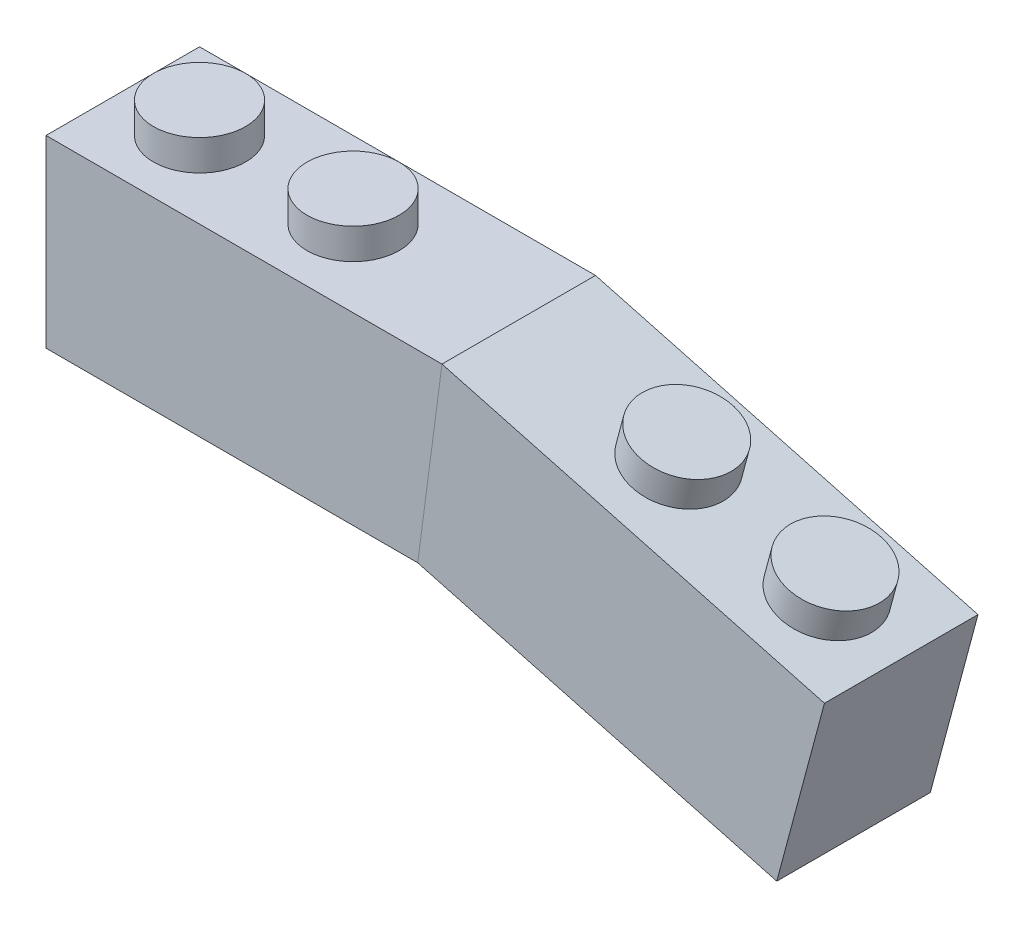
from build123d import *

# Parameters (mm, degrees)
SKETCH2_W           = 8
SKETCH2_H           = 9.6
SKETCH4_R           = 2.4
BOSS_EXTRUDE1_DEPTH = 1.6
LPATTERN1_COUNT     = 2
LPATTERN1_PITCH     = 8
SKETCH5_R           = 2.4
BOSS_EXTRUDE2_DEPTH = 1.6
LPATTERN2_COUNT     = 2
LPATTERN2_PITCH     = 8
SHELL1_T            = -1.6


with BuildPart() as part:
    # Sweep1: sweep along a path in Sketch3
    with BuildLine(Plane.XY) as sweep1_path:
        Line((0, 0), (20, 0))
        Line((20, 0), (39.318516526, -5.176380902))
    # Sketch2 → Sweep1 (sweep)
    with BuildSketch(Plane(origin=(0, 0, 0), x_dir=(0, 0, -1), z_dir=(1, 0, 0))):
        Rectangle(SKETCH2_W, SKETCH2_H)
    sweep(path=sweep1_path.line, transition=Transition.RIGHT)

    # Sketch4 → Boss-Extrude1 (add)
    with BuildSketch(Plane(origin=(0, 4.8, 0), x_dir=(1, 0, 0), z_dir=(0, 1, 0))):
        with Locations(Location((4, 0, 0), (0, 0, 270))):
            Circle(SKETCH4_R)
    boss_extrude1 = extrude(amount=BOSS_EXTRUDE1_DEPTH)

    # LPattern1: Boss-Extrude1 ×2
    with Locations(*[(i * LPATTERN1_PITCH, 0, 0) for i in range(1, LPATTERN1_COUNT)]):
        add(boss_extrude1)

    # Sketch5 → Boss-Extrude2 (add)
    with BuildSketch(Plane(origin=(2.582077379, 9.636443966, 0), x_dir=(0.9659258262890681, -0.25881904510252135, 0), z_dir=(0.25881904510252135, 0.9659258262890681, 0))):
        with Locations(Location((35.318516526, 0, 0), (0, 0, 180))):
            Circle(SKETCH5_R)
    boss_extrude2 = extrude(amount=BOSS_EXTRUDE2_DEPTH)

    # LPattern2: Boss-Extrude2 ×2
    with Locations(*[Vector(-0.9659258262890681, 0.2588190451025216, 0) * (i * LPATTERN2_PITCH) for i in range(1, LPATTERN2_COUNT)]):
        add(boss_extrude2)

    # Shell1
    shell1_openings = [part.faces().sort_by_distance(p)[0] for p in [
        (9.684034006, -4.8, 0),
        (28.72212656, -7.306412434, 0),
    ]]
    offset(amount=SHELL1_T, openings=shell1_openings, kind=Kind.INTERSECTION)


solid = part.part
